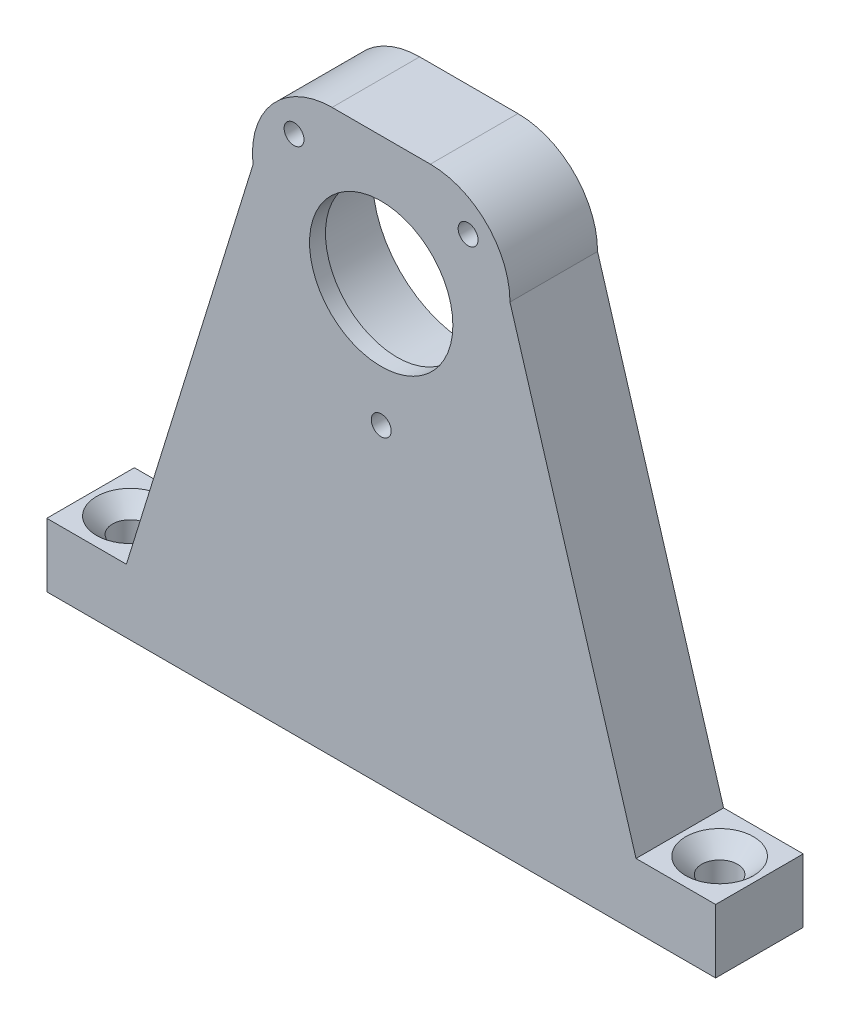
from build123d import *

# Parameters (mm, degrees)
SCHIZZO1_R                   = 12.1
ESTRUSIONE_ESTRUSIONE1_DEPTH = 11
ESTRUSIONE_ESTRUSIONE2_START = -2
SCHIZZO2_R                   = 12.1
SCHIZZO2_R_2                 = 9
ESTRUSIONE_ESTRUSIONE2_DEPTH = 2
SCHIZZO3_R                   = 2.25
TAGLIO_ESTRUSIONE1_DEPTH     = 77.182412669
SMUSSO1_SIZE                 = 2
SCHIZZO4_R                   = 1.25
TAGLIO_ESTRUSIONE2_DEPTH     = 70.679623994


with BuildPart() as part:
    # Schizzo1 → Estrusione-Estrusione1 (new body)
    with BuildSketch(Plane.XY):
        with BuildLine():
            Line((-6.171311325, 16.1), (6.171311325, 16.1))
            ThreePointArc((6.171311325, 16.1), (13.242379137, 13.171067812), (16.171311325, 6.1))
            Line((16.171311325, 6.1), (32, -46.5))
            Line((32, -46.5), (42, -46.5))
            Line((42, -46.5), (42, -54.5))
            Line((42, -54.5), (17, -54.5))
            Line((17, -54.5), (-17, -54.5))
            Line((-17, -54.5), (-42, -54.5))
            Line((-42, -54.5), (-42, -46.5))
            Line((-42, -46.5), (-32, -46.5))
            Line((-32, -46.5), (-16.1, 4.907883736))
            ThreePointArc((-16.1, 4.907883736), (-13.651991863, 12.73622021), (-6.171311325, 16.1))
        make_face()
        Circle(SCHIZZO1_R, mode=Mode.SUBTRACT)
    extrude(amount=ESTRUSIONE_ESTRUSIONE1_DEPTH)

    # Schizzo2 → Estrusione-Estrusione2 (add)
    with BuildSketch(Plane.XY.offset(11).offset(ESTRUSIONE_ESTRUSIONE2_START)):
        Circle(SCHIZZO2_R)
        Circle(SCHIZZO2_R_2, mode=Mode.SUBTRACT)
    extrude(amount=ESTRUSIONE_ESTRUSIONE2_DEPTH)

    # Schizzo3 → Taglio-Estrusione1 (cut, through all)
    with BuildSketch(Plane(origin=(0, -46.5, 0), x_dir=(1, 0, 0), z_dir=(0, 1, 0))):
        with Locations(Location((37, -5.5, 0), (0, 0, 270))):
            Circle(SCHIZZO3_R)
        with Locations(Location((-37, -5.5, 0), (0, 0, 270))):
            Circle(SCHIZZO3_R)
    extrude(amount=-TAGLIO_ESTRUSIONE1_DEPTH, mode=Mode.SUBTRACT)

    # Smusso1
    smusso1_edges = [part.edges().sort_by_distance(p)[0] for p in [
        (37, -46.5, 3.25),
        (-37, -46.5, 3.25),
    ]]
    chamfer(smusso1_edges, length=SMUSSO1_SIZE)

    # Schizzo4 → Taglio-Estrusione2 (cut, through all)
    with BuildSketch(Plane(origin=(0, 0, 0), x_dir=(-1, 0, 0), z_dir=(0, 0, -1))):
        with Locations((-10.910719744, 10.851964601)):
            Circle(SCHIZZO4_R)
        with Locations((10.944459062, 10.817992606)):
            Circle(SCHIZZO4_R)
        with Locations((0, -15.38859776)):
            Circle(SCHIZZO4_R)
    extrude(amount=-TAGLIO_ESTRUSIONE2_DEPTH, mode=Mode.SUBTRACT)


solid = part.part
